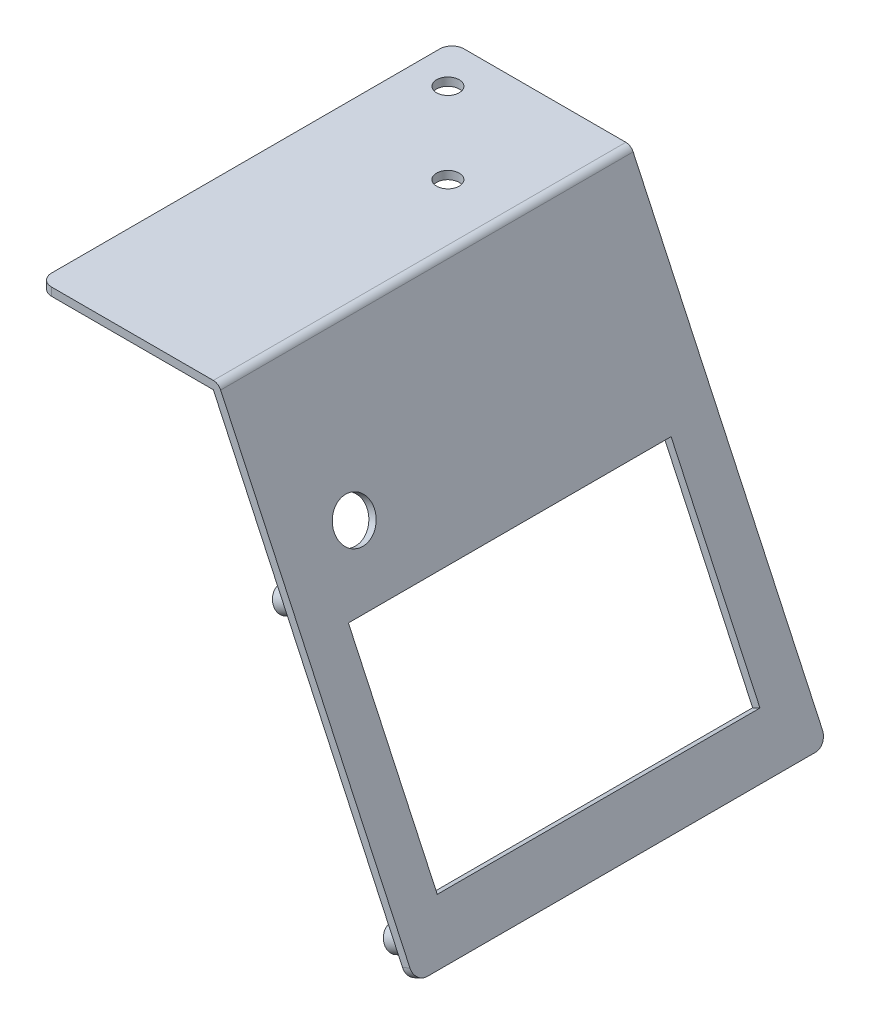
from build123d import *

# Parameters (mm, degrees)
SALIENTE_EXTRUIR1_DEPTH             = 102
CROQUIS2_W                          = 79.8
CROQUIS2_H                          = 52
CORTAR_EXTRUIR1_DEPTH               = 169.784535141
DI_METRO_DE_TALADRO_10_0_10_1_D     = 10
DI_METRO_DE_TALADRO_10_0_10_1_DEPTH = 46.047555479
DI_METRO_DE_TALADRO_5_6_5_6_1_D     = 5.6
DI_METRO_DE_TALADRO_2_7_2_7_1_D     = 2.7
DI_METRO_DE_TALADRO_2_7_2_7_1_DEPTH = 7
REDONDEO1_R                         = 2
REDONDEO2_R                         = 3


with BuildPart() as part:
    # Croquis1 → Saliente-Extruir1 (new body)
    with BuildSketch(Plane(origin=(0, 0, 0), x_dir=(-1, 0, 0), z_dir=(0, 0, -1))):
        Polygon((-91.062625048, -105.070632033), (-43, -2), (0, -2), (0, 0), (-44.274140522, 0), (-92.875240622, -104.225395509), align=None)
    extrude(amount=-SALIENTE_EXTRUIR1_DEPTH)

    # Croquis2 → Cortar-Extruir1 (cut, through all)
    with BuildSketch(Plane(origin=(36.366504739, 16.95797966, 0), x_dir=(0, 0, -1), z_dir=(0.9063077870366478, 0.4226182617407038, 0))):
        with Locations((-51.4, -95.405591591)):
            Rectangle(CROQUIS2_W, CROQUIS2_H)
    extrude(amount=-CORTAR_EXTRUIR1_DEPTH, mode=Mode.SUBTRACT)

    # Croquis3 → Revolución1 (revolve)
    with BuildSketch(Plane(origin=(0, 0, 95.95), x_dir=(-1, 0, 0), z_dir=(0, 0, -1)), mode=Mode.PRIVATE) as revoluci_n1_sk:
        Polygon((-56.083772126, -46.621650953), (-54.815917341, -43.902727592), (-61.16007185, -40.94439976), (-62.427926635, -43.663323121), align=None)
    revolve(revoluci_n1_sk.sketch.rotate(Axis((53.774509275, -44.388344148, 95.95), (0.906307787036648, 0.4226182617407037, 0)), 180), axis=Axis((53.774509275, -44.388344148, 95.95), (0.906307787036648, 0.4226182617407037, 0)))

    # Croquis4 → Revolución2 (revolve)
    with BuildSketch(Plane(origin=(0, 0, 95.95), x_dir=(-1, 0, 0), z_dir=(0, 0, -1)), mode=Mode.PRIVATE) as revoluci_n2_sk:
        Polygon((-83.511697313, -105.441026332), (-82.243842528, -102.722102971), (-88.587997037, -99.763775138), (-89.855851822, -102.482698499), align=None)
    revolve(revoluci_n2_sk.sketch.rotate(Axis((81.202434462, -103.207719527, 95.95), (0.9063077870366476, 0.4226182617407046, 0)), 180), axis=Axis((81.202434462, -103.207719527, 95.95), (0.9063077870366476, 0.4226182617407046, 0)))

    # Croquis5 → Revolución3 (revolve)
    with BuildSketch(Plane(origin=(0, 0, 8.05), x_dir=(-1, 0, 0), z_dir=(0, 0, -1)), mode=Mode.PRIVATE) as revoluci_n3_sk:
        Polygon((-83.511697313, -105.441026332), (-82.243842528, -102.722102971), (-88.587997037, -99.763775138), (-89.855851822, -102.482698499), align=None)
    revolve(revoluci_n3_sk.sketch.rotate(Axis((81.202434462, -103.207719527, 8.05), (0.9063077870366479, 0.422618261740704, 0)), 180), axis=Axis((81.202434462, -103.207719527, 8.05), (0.9063077870366479, 0.422618261740704, 0)))

    # Croquis6 → Revolución4 (revolve)
    with BuildSketch(Plane(origin=(0, 0, 8.05), x_dir=(-1, 0, 0), z_dir=(0, 0, -1)), mode=Mode.PRIVATE) as revoluci_n4_sk:
        Polygon((-56.083772126, -46.621650953), (-54.815917341, -43.902727592), (-61.16007185, -40.94439976), (-62.427926635, -43.663323121), align=None)
    revolve(revoluci_n4_sk.sketch.rotate(Axis((53.774509275, -44.388344148, 8.05), (0.906307787036648, 0.42261826174070366, 0)), 180), axis=Axis((53.774509275, -44.388344148, 8.05), (0.906307787036648, 0.42261826174070366, 0)))

    # Diámetro de taladro Ø10.0 (10)1
    with Locations(Plane(origin=(34.553889165, 16.112743137, 0), x_dir=(0, 0, 1), z_dir=(-0.9063077870366479, -0.4226182617407037, 0))):
        with Locations((83.1, -53.405591591)):
            Hole(DI_METRO_DE_TALADRO_10_0_10_1_D / 2, depth=DI_METRO_DE_TALADRO_10_0_10_1_DEPTH)

    # Diámetro de taladro Ø5.6 (5.6)1 (through all)
    with Locations(Plane(origin=(0, -2, 0), x_dir=(-1, 0, 0), z_dir=(0, -1, 0))):
        with Locations((-29, -30), (-9, -10)):
            Hole(DI_METRO_DE_TALADRO_5_6_5_6_1_D / 2)

    # Diámetro de taladro Ø2.7 (2.7)1
    with Locations(Plane(origin=(28.209734656, 13.154415305, 0), x_dir=(0, 0, 1), z_dir=(-0.906307787036648, -0.42261826174070377, 0))):
        with Locations((8.05, -62.955591591), (8.05, -127.855591591), (95.95, -127.855591591), (95.95, -62.955591591)):
            Hole(DI_METRO_DE_TALADRO_2_7_2_7_1_D / 2, depth=DI_METRO_DE_TALADRO_2_7_2_7_1_DEPTH)

    # Redondeo1
    redondeo1_edges = [part.edges().sort_by_distance(p)[0] for p in [
        (44.274140522, 0, 51),
    ]]
    fillet(redondeo1_edges, radius=REDONDEO1_R)

    # Redondeo2
    redondeo2_edges = [part.edges().sort_by_distance(p)[0] for p in [
        (0, -1, 102),
        (91.968932835, -104.648013771, 102),
        (0, -1, 0),
        (91.968932835, -104.648013771, 0),
    ]]
    fillet(redondeo2_edges, radius=REDONDEO2_R)


solid = part.part
